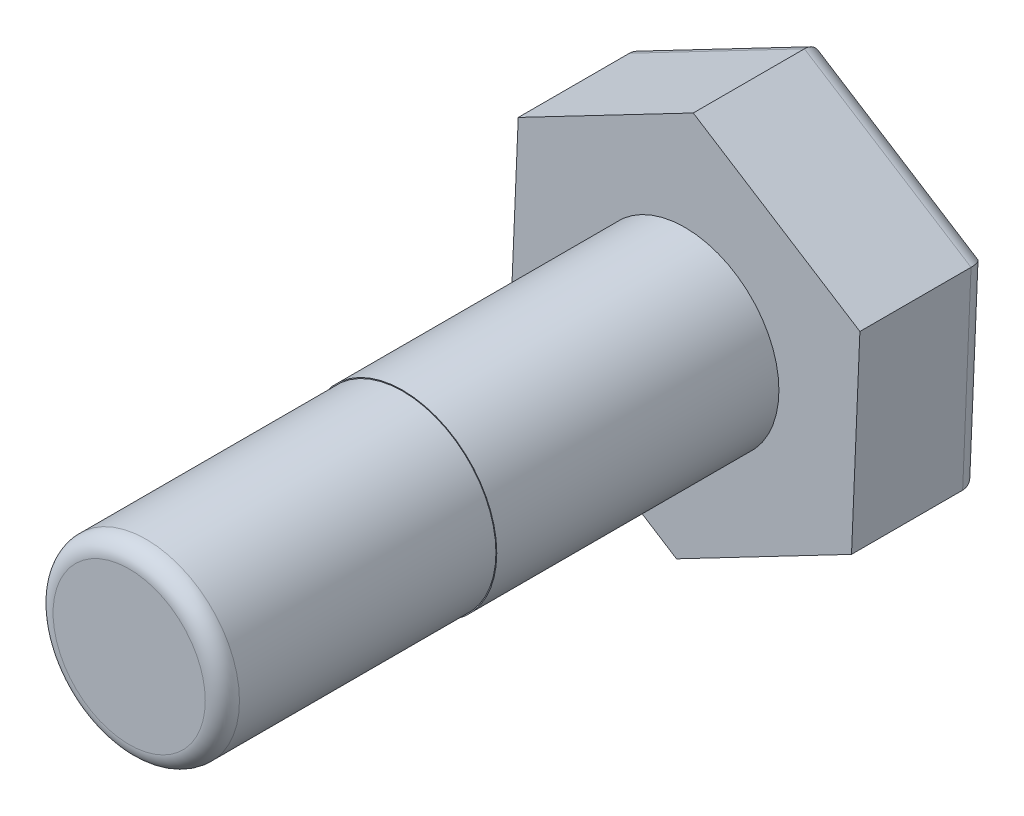
from build123d import *

# Parameters (mm, degrees)
EXTRUDE_345_DEPTH = 15
SKETCH_2_R        = 11
EXTRUDE_1_DEPTH   = 33
FILLET_3_R        = 2
SKETCH_3_R        = 10.9
EXTRUDE_1_2_DEPTH = 32
FILLET_4_R        = 2


with BuildPart() as part:
    # 草图1 → Extrude 345 (new body)
    with BuildSketch(Plane.XY):
        Polygon((20.472392036, 10.687118304), (0.980880074, 23.073170732), (-19.491511963, 12.386052428), (-20.472392036, -10.687118304), (-0.980880074, -23.073170732), (19.491511963, -12.386052428), align=None)
    extrude(amount=EXTRUDE_345_DEPTH)

    # 草图2 → Extrude 1 (add)
    with BuildSketch(Plane.XY.offset(15)):
        Circle(SKETCH_2_R)
    extrude(amount=EXTRUDE_1_DEPTH)

    # 圆角3
    fillet_3_edges = [part.edges().sort_by_distance(p)[0] for p in [
        (9.255315945, -17.72961158, 0),
        (-10.726636055, -16.880144518, 0),
        (-19.981952, 0.849467062, 0),
        (-9.255315945, 17.72961158, 0),
        (10.726636055, 16.880144518, 0),
        (19.981952, -0.849467062, 0),
    ]]
    fillet(fillet_3_edges, radius=FILLET_3_R)

    # 草图3 → Extrude 1 2 (add)
    with BuildSketch(Plane.XY.offset(48)):
        Circle(SKETCH_3_R)
    extrude(amount=EXTRUDE_1_2_DEPTH)

    # 圆角4
    fillet_4_edges = [part.edges().sort_by_distance(p)[0] for p in [
        (-10.9, 0, 80),
    ]]
    fillet(fillet_4_edges, radius=FILLET_4_R)


solid = part.part
